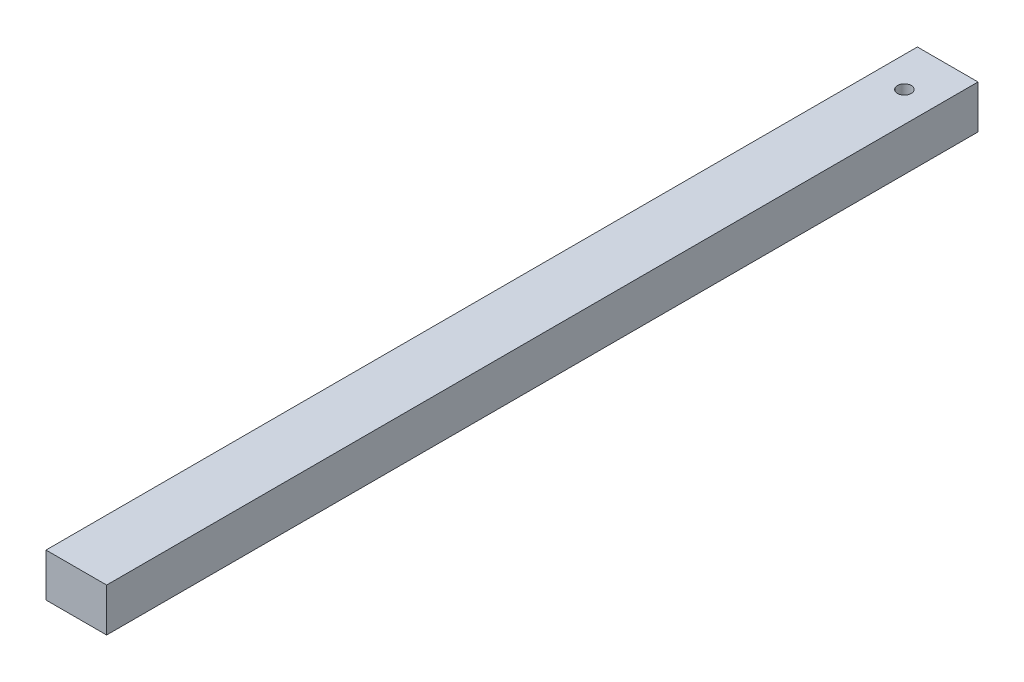
from build123d import *

# Parameters (mm, degrees)
SKETCH2_W           = 35
SKETCH2_H           = 25
BOSS_EXTRUDE1_DEPTH = 503
SKETCH3_R           = 4
CUT_EXTRUDE2_DEPTH  = 504.924845587


with BuildPart() as part:
    # Sketch2 → Boss-Extrude1 (new body)
    with BuildSketch(Plane.XY):
        Rectangle(SKETCH2_W, SKETCH2_H)
    extrude(amount=BOSS_EXTRUDE1_DEPTH)

    # Sketch3 → Cut-Extrude2 (cut, through all)
    with BuildSketch(Plane(origin=(0, 12.5, 0), x_dir=(1, 0, 0), z_dir=(0, 1, 0))):
        with Locations(Location((0, -25, 0), (0, 0, 270))):
            Circle(SKETCH3_R)
    extrude(amount=-CUT_EXTRUDE2_DEPTH, mode=Mode.SUBTRACT)


solid = part.part
